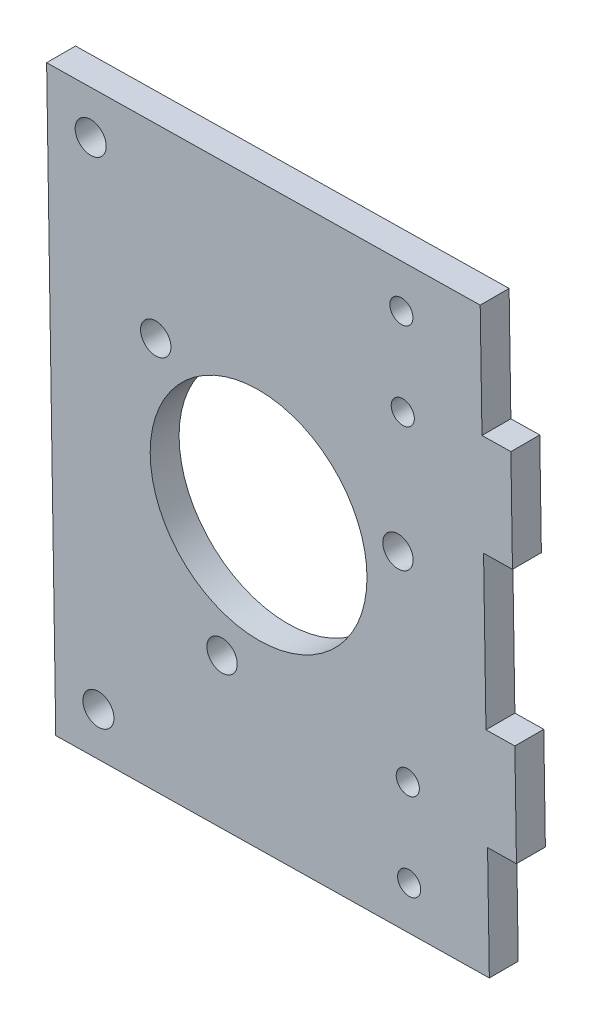
from build123d import *

# Parameters (mm, degrees)
EXTRUDE_1_DEPTH     = 4
SKETCH_3_R          = 15
SKETCH_3_R_2        = 2.1
CUT_EXTRUDE_1_DEPTH = 4
SKETCH_4_R          = 2.15
CUT_EXTRUDE_2_DEPTH = 4
SKETCH_5_R          = 1.6
CUT_EXTRUDE_3_DEPTH = 4
EXTRUDE_2_DEPTH     = 4


with BuildPart() as part:
    # 草图2 → 凸台-拉伸1 (new body)
    with BuildSketch(Plane.XY):
        Polygon((131.137809217, 89.374251193), (132.400858097, 9.374251193), (72.408334633, 8.427082574), (71.145285753, 88.427082574), align=None)
    extrude(amount=EXTRUDE_1_DEPTH)

    # 草图3 → 切除-拉伸1 (cut)
    with BuildSketch(Plane.XY.offset(4)):
        with Locations((100.473333038, 48.885132061)):
            Circle(SKETCH_3_R)
        with Locations((119.759256959, 54.181653421)):
            Circle(SKETCH_3_R_2)
        with Locations((95.417293127, 29.53477133)):
            Circle(SKETCH_3_R_2)
        with Locations((86.243449028, 62.938971432)):
            Circle(SKETCH_3_R_2)
    extrude(amount=-CUT_EXTRUDE_1_DEPTH, mode=Mode.SUBTRACT)

    # 草图4 → 切除-拉伸2 (cut)
    with BuildSketch(Plane.XY.offset(4)):
        with Locations((77.239254962, 82.522547089)):
            Circle(SKETCH_4_R)
        with Locations((78.31271273, 14.531020496)):
            Circle(SKETCH_4_R)
    extrude(amount=-CUT_EXTRUDE_2_DEPTH, mode=Mode.SUBTRACT)

    # 草图5 → 切除-拉伸3 (cut)
    with BuildSketch(Plane.XY.offset(4)):
        with Locations((120.233896778, 83.201351266)):
            Circle(SKETCH_5_R)
        with Locations((120.423330501, 71.202846573)):
            Circle(SKETCH_5_R)
        with Locations((121.117920822, 27.208329366)):
            Circle(SKETCH_5_R)
        with Locations((121.307354546, 15.209824673)):
            Circle(SKETCH_5_R)
    extrude(amount=-CUT_EXTRUDE_3_DEPTH, mode=Mode.SUBTRACT)

    # 草图6 → 凸台-拉伸2 (add)
    with BuildSketch(Plane.XY.offset(4)):
        Polygon((132.156015483, 24.882288469), (131.934981929, 38.882288469), (135.934483494, 38.945433043), (136.155517047, 24.945433043), align=None)
        Polygon((131.603500455, 59.877927156), (131.382494444, 73.876182631), (135.381996008, 73.939327206), (135.60300202, 59.941071731), align=None)
    extrude(amount=-EXTRUDE_2_DEPTH)


solid = part.part
